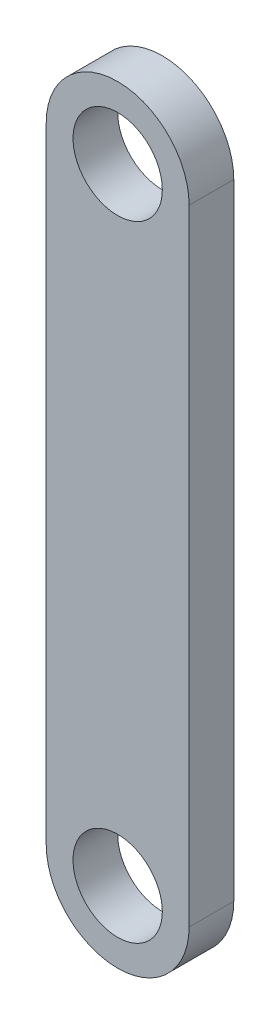
from build123d import *

# Parameters (mm, degrees)
SKETCH_1_R      = 0.5
EXTRUDE_1_DEPTH = 0.5


with BuildPart() as part:
    # 草圖1 → 填料-伸長1 (new body)
    with BuildSketch(Plane.XY):
        with BuildLine():
            Line((-0.8, -3.5), (-0.8, 3.5))
            ThreePointArc((-0.8, 3.5), (0, 4.3), (0.8, 3.5))
            Line((0.8, 3.5), (0.8, -3.5))
            ThreePointArc((0.8, -3.5), (0, -4.3), (-0.8, -3.5))
        make_face()
        with Locations((0, 3.5)):
            Circle(SKETCH_1_R, mode=Mode.SUBTRACT)
        with Locations((0, -3.5)):
            Circle(SKETCH_1_R, mode=Mode.SUBTRACT)
    extrude(amount=EXTRUDE_1_DEPTH)


solid = part.part
